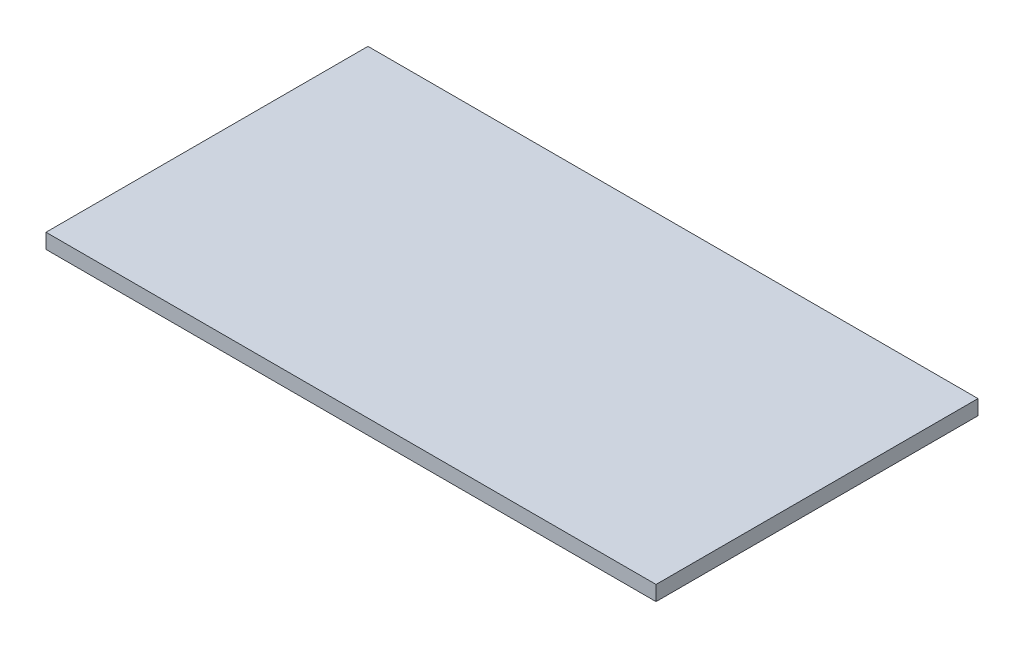
from build123d import *

# Parameters (mm, degrees)
SKETCH1_W           = 228.6
SKETCH1_H           = 120.65
BOSS_EXTRUDE1_DEPTH = 5.588


with BuildPart() as part:
    # Sketch1 → Boss-Extrude1 (new body)
    with BuildSketch(Plane(origin=(0, 0, 0), x_dir=(1, 0, 0), z_dir=(0, 1, 0))):
        Rectangle(SKETCH1_W, SKETCH1_H)
    extrude(amount=BOSS_EXTRUDE1_DEPTH)


solid = part.part
